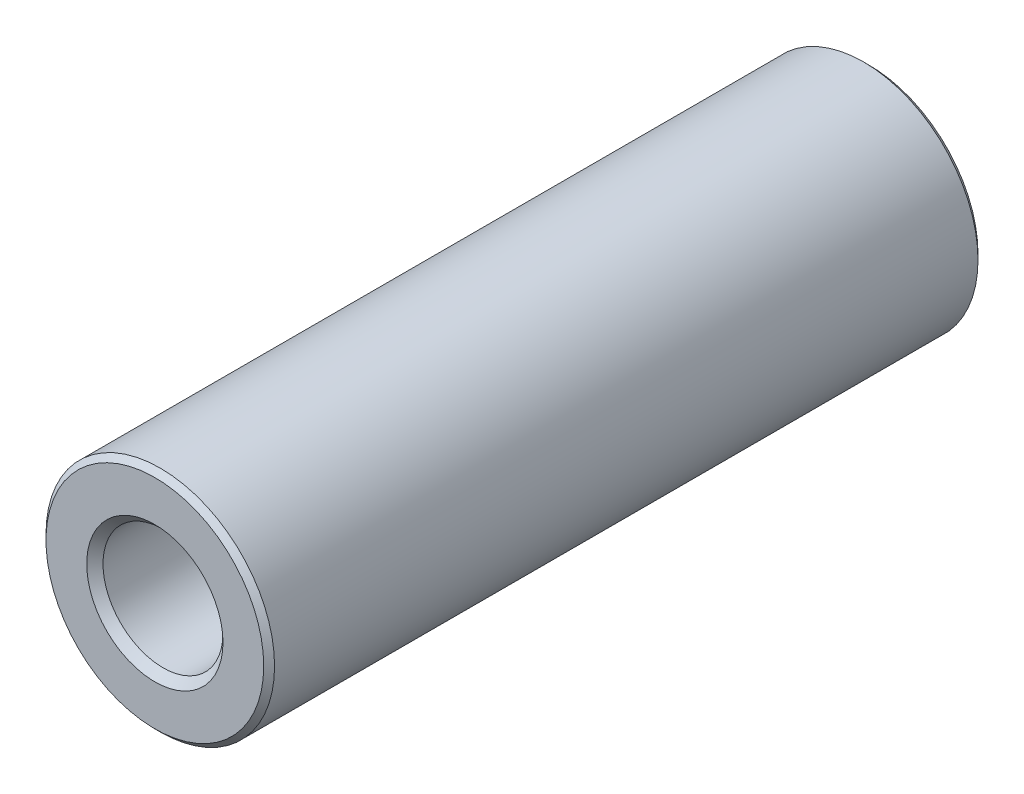
from build123d import *

# Parameters (mm, degrees)
BOSS_EXTRUDE1_DEPTH      = 12.5
BOSS_EXTRUDE1_DEPTH_BACK = 12.5
SKETCH3_R                = 4
SKETCH3_R_2              = 2.1
CHAMFER1_SIZE            = 0.19
CHAMFER2_SIZE            = 0.285


with BuildPart() as part:
    # Sketch3 → Boss-Extrude1 (new, two sides: drawn at the far end of the back side and taken through both)
    with BuildSketch(Plane.XY.offset(-BOSS_EXTRUDE1_DEPTH_BACK)):
        Circle(SKETCH3_R)
        Circle(SKETCH3_R_2, mode=Mode.SUBTRACT)
    extrude(amount=BOSS_EXTRUDE1_DEPTH + BOSS_EXTRUDE1_DEPTH_BACK)

    # Chamfer1
    chamfer1_edges = [part.edges().sort_by_distance(p)[0] for p in [
        (-4, 0, -12.5),
        (-4, 0, 12.5),
    ]]
    chamfer(chamfer1_edges, length=CHAMFER1_SIZE)

    # Chamfer2
    chamfer2_edges = [part.edges().sort_by_distance(p)[0] for p in [
        (-2.1, 0, -12.5),
        (-2.1, 0, 12.5),
    ]]
    chamfer(chamfer2_edges, length=CHAMFER2_SIZE)


solid = part.part
